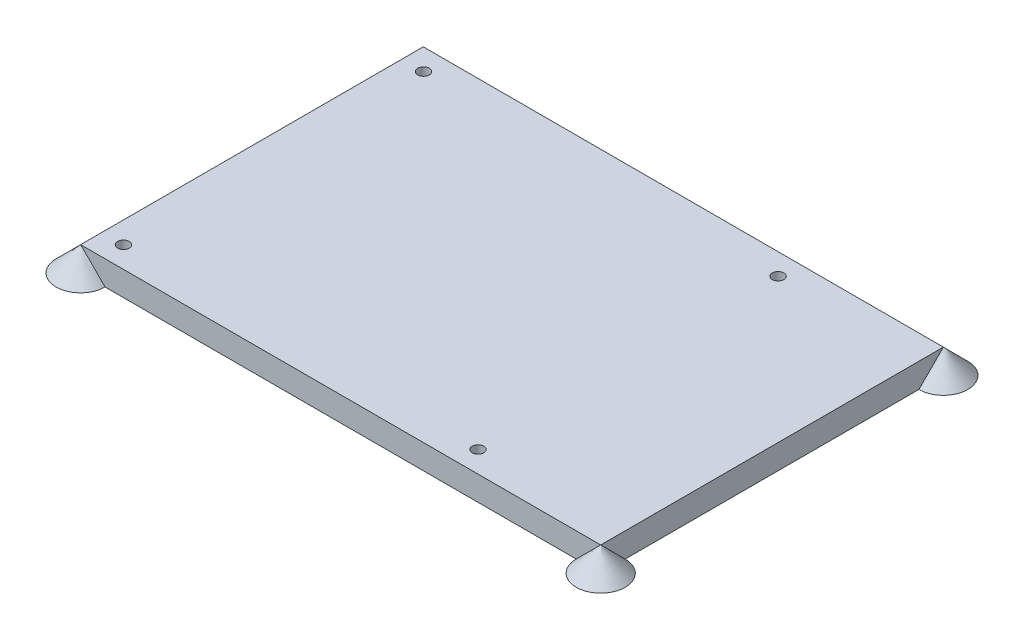
from build123d import *
from build123d.topology import SkipClean

# Parameters (mm, degrees)
SKETCH1_W           = 85
SKETCH1_H           = 56
SKETCH1_R           = 0.95
BOSS_EXTRUDE2_DEPTH = 4


with BuildPart() as part:
    # Sketch1 → Boss-Extrude2 (new body)
    with BuildSketch(Plane(origin=(0, 0, 0), x_dir=(1, 0, 0), z_dir=(0, 1, 0))):
        Rectangle(SKETCH1_W, SKETCH1_H)
        with Locations(Location((-38.98, -24.52, 0), (0, 0, 270))):
            Circle(SKETCH1_R, mode=Mode.SUBTRACT)
        with Locations(Location((18.96, -24.52, 0), (0, 0, 90))):
            Circle(SKETCH1_R, mode=Mode.SUBTRACT)
        with Locations(Location((18.96, 24.52, 0), (0, 0, 270))):
            Circle(SKETCH1_R, mode=Mode.SUBTRACT)
        with Locations(Location((-38.98, 24.52, 0), (0, 0, 90))):
            Circle(SKETCH1_R, mode=Mode.SUBTRACT)
    extrude(amount=BOSS_EXTRUDE2_DEPTH)

    # Sketch6 → Revolve1 (revolve)
    with SkipClean():  # the faces are left unmerged after this step: merging them gives an invalid solid
        with BuildSketch(Plane(origin=(-7.25, 0, -7.25), x_dir=(0.7071067811865475, 0, -0.7071067811865477), z_dir=(0.7071067811865477, 0, 0.7071067811865475))):
            Polygon((-49.851028074, 4), (-53.851028074, 0), (-49.851028074, 0), align=None)
        revolve1 = revolve(axis=Axis((-42.5, 0, 28), (0, 1, 0)))

    # Mirror1: Revolve1 across plane
    with SkipClean():  # the faces are left unmerged after this step: merging them gives an invalid solid
        add(revolve1.mirror(Plane(origin=(0, 0, 0), x_dir=(0, 0, 1), z_dir=(1, 0, 0))))

    # Mirror1 at the second plane: Revolve1 across plane
    with SkipClean():  # the faces are left unmerged after this step: merging them gives an invalid solid
        add(revolve1.mirror(Plane.XY))

    # Mirror1 at the second plane copy 1 sketc → Mirror1 at the second plane copy 1 (revolve)
    with SkipClean():  # the faces are left unmerged after this step: merging them gives an invalid solid
        with BuildSketch(Plane(origin=(7.25, 0, 7.25), x_dir=(-0.7071067811865475, 0, 0.7071067811865477), z_dir=(-0.7071067811865477, 0, -0.7071067811865475))):
            Polygon((-49.851028074, 4), (-53.851028074, 0), (-49.851028074, 0), align=None)
        revolve(axis=Axis((42.5, 0, -28), (0, 1, 0)))


solid = part.part
